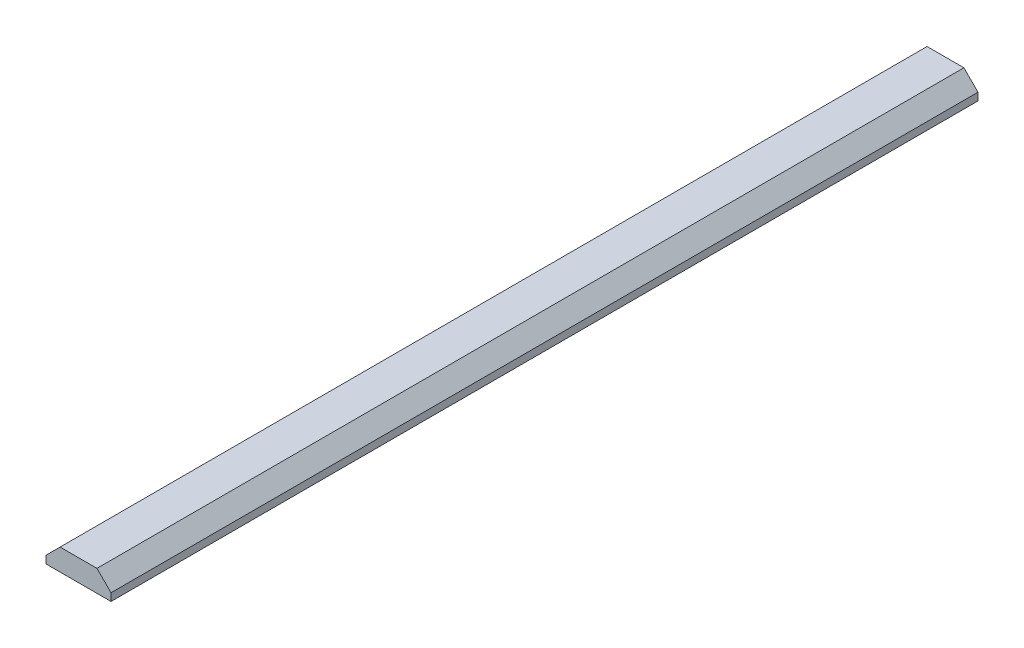
from build123d import *

# Parameters (mm, degrees)
AUFSATZ_LINEAR_AUSTRAGEN1_DEPTH = 160


with BuildPart() as part:
    # Skizze1 → Aufsatz-Linear austragen1 (new body)
    with BuildSketch(Plane.XY):
        Polygon((3.4, 1.808858787), (-3.4, 1.808858787), (-6, -0.791141213), (-6, -2.191141213), (6, -2.191141213), (6, -0.791141213), align=None)
    extrude(amount=AUFSATZ_LINEAR_AUSTRAGEN1_DEPTH)


solid = part.part
